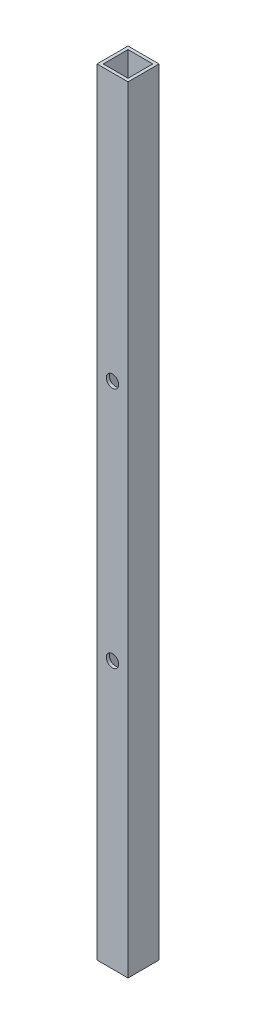
from build123d import *

# Parameters (mm, degrees)
SKETCH_1_W            = 10
SKETCH_1_H            = 10
SKETCH_1_W_2          = 8
SKETCH_1_H_2          = 8
EXTRUDE_1_DEPTH       = 250
HOLE_WIZARD_4_0_4_1_D = 4


with BuildPart() as part:
    # 草图1 → 凸台-拉伸1 (new body)
    with BuildSketch(Plane(origin=(0, 0, 0), x_dir=(1, 0, 0), z_dir=(0, 1, 0))):
        Rectangle(SKETCH_1_W, SKETCH_1_H)
        Rectangle(SKETCH_1_W_2, SKETCH_1_H_2, mode=Mode.SUBTRACT)
    extrude(amount=EXTRUDE_1_DEPTH)

    # Ø4.0 (4) 直径孔1 (through all)
    with Locations(Plane(origin=(0, 0, -5), x_dir=(-1, 0, 0), z_dir=(0, 0, -1))):
        with Locations((0, 164)):
            hole_wizard_4_0_4_1 = Hole(HOLE_WIZARD_4_0_4_1_D / 2)

    # 镜向1: Ø4.0 (4) 直径孔1 across plane
    add(hole_wizard_4_0_4_1.mirror(Plane.ZX.offset(125)), mode=Mode.SUBTRACT)


solid = part.part
